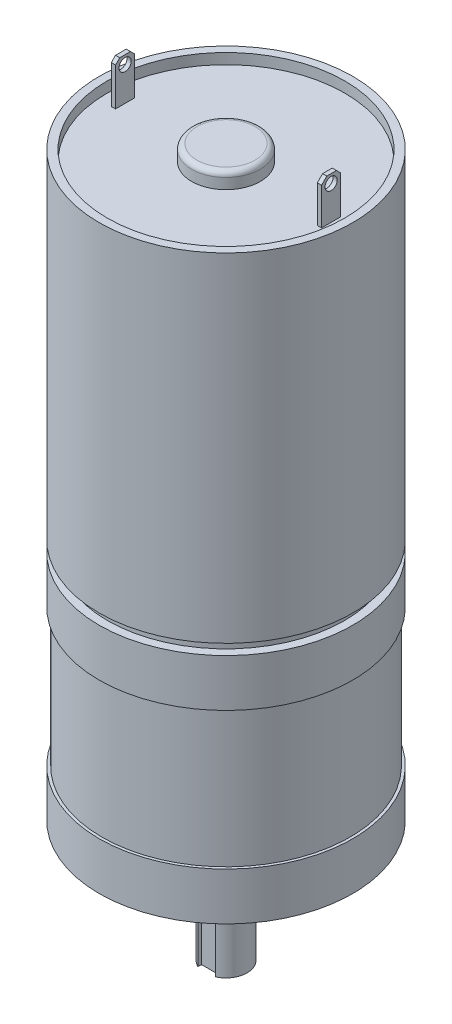
from build123d import *

# Parameters (mm, degrees)
SKETCH2_R           = 12
BOSS_EXTRUDE1_DEPTH = 27.5
SKETCH3_R           = 11.245365849
CUT_EXTRUDE1_DEPTH  = 1
CUT_EXTRUDE2_START  = -23
SKETCH4_R           = 12
SKETCH4_R_2         = 11.226713735
CUT_EXTRUDE2_DEPTH  = 1
CUT_EXTRUDE7_START  = -11
SKETCH5_R           = 12
SKETCH5_R_2         = 11.742388301
CUT_EXTRUDE7_DEPTH  = 6.5
SKETCH6_R           = 3.5
BOSS_EXTRUDE2_DEPTH = 2.5
SKETCH7_R           = 2
BOSS_EXTRUDE3_DEPTH = 9
CUT_EXTRUDE9_DEPTH  = 8
SKETCH9_R           = 3.25
BOSS_EXTRUDE4_DEPTH = 1.5
FILLET2_R           = 0.5
SKETCH10_W          = 0.399131897
SKETCH10_H          = 1.813679108
BOSS_EXTRUDE5_DEPTH = 4
CHAMFER1_SIZE       = 0.4
CHAMFER2_SIZE       = 0.5
SKETCH11_R          = 0.578483289
CUT_EXTRUDE10_DEPTH = 4
CHAMFER3_SIZE       = 0.4
CHAMFER4_SIZE       = 0.4


with BuildPart() as part:
    # Sketch2 → Boss-Extrude1 (new, symmetric)
    with BuildSketch(Plane(origin=(0, 0, 0), x_dir=(1, 0, 0), z_dir=(0, 1, 0))):
        with Locations(Location((0, 0, 0), (0, 0, 270))):
            Circle(SKETCH2_R)
    extrude(amount=BOSS_EXTRUDE1_DEPTH, both=True)

    # Sketch3 → Cut-Extrude1 (cut)
    with BuildSketch(Plane(origin=(0, 27.5, 0), x_dir=(1, 0, 0), z_dir=(0, 1, 0))):
        with Locations(Location((0, 0, 0), (0, 0, 270))):
            Circle(SKETCH3_R)
    extrude(amount=-CUT_EXTRUDE1_DEPTH, mode=Mode.SUBTRACT)

    # Sketch4 → Cut-Extrude2 (cut)
    with BuildSketch(Plane.XZ.offset(27.5).offset(CUT_EXTRUDE2_START)):
        with Locations(Location((0, 0, 0), (0, 0, 270))):
            Circle(SKETCH4_R)
        with Locations(Location((0, 0, 0), (0, 0, 270))):
            Circle(SKETCH4_R_2, mode=Mode.SUBTRACT)
    extrude(amount=CUT_EXTRUDE2_DEPTH, mode=Mode.SUBTRACT)

    # Sketch5 → Cut-Extrude7 (cut, symmetric)
    with BuildSketch(Plane.XZ.offset(27.5).offset(CUT_EXTRUDE7_START)):
        with Locations(Location((0, 0, 0), (0, 0, 270))):
            Circle(SKETCH5_R)
        with Locations(Location((0, 0, 0), (0, 0, 270))):
            Circle(SKETCH5_R_2, mode=Mode.SUBTRACT)
    extrude(amount=CUT_EXTRUDE7_DEPTH, both=True, mode=Mode.SUBTRACT)

    # Sketch6 → Boss-Extrude2 (add)
    with BuildSketch(Plane.XZ.offset(27.5)):
        with Locations(Location((0, 0, 0), (0, 0, 270))):
            Circle(SKETCH6_R)
    extrude(amount=BOSS_EXTRUDE2_DEPTH)

    # Sketch7 → Boss-Extrude3 (add)
    with BuildSketch(Plane.XZ.offset(30)):
        with Locations(Location((0, 0, 0), (0, 0, 270))):
            Circle(SKETCH7_R)
    extrude(amount=BOSS_EXTRUDE3_DEPTH)

    # Sketch8 → Cut-Extrude9 (cut)
    with BuildSketch(Plane.XZ.offset(39)):
        Polygon((0.841690599, 1.659275507), (0.841690599, 2.202635472), (-0.841690599, 2.202635472), (-0.841690599, 1.659275507), (-0.841690599, 1.478155518), (0.841690599, 1.478155518), align=None)
    extrude(amount=-CUT_EXTRUDE9_DEPTH, mode=Mode.SUBTRACT)

    # Sketch9 → Boss-Extrude4 (add)
    with BuildSketch(Plane(origin=(0, 26.5, 0), x_dir=(1, 0, 0), z_dir=(0, 1, 0))):
        with Locations(Location((0, 0, 0), (0, 0, 270))):
            Circle(SKETCH9_R)
    extrude(amount=BOSS_EXTRUDE4_DEPTH)

    # Fillet2
    fillet2_edges = [part.edges().sort_by_distance(p)[0] for p in [
        (0, 28, -3.25),
    ]]
    fillet(fillet2_edges, radius=FILLET2_R)

    # Sketch10 → Boss-Extrude5 (add)
    with BuildSketch(Plane(origin=(0, 26.5, 0), x_dir=(1, 0, 0), z_dir=(0, 1, 0))):
        with Locations((9.751397246, 0)):
            Rectangle(SKETCH10_W, SKETCH10_H)
    boss_extrude5 = extrude(amount=BOSS_EXTRUDE5_DEPTH)

    # Chamfer1
    chamfer1_edges = [part.edges().sort_by_distance(p)[0] for p in [
        (9.751397246, 30.5, -0.906839554),
    ]]
    chamfer(chamfer1_edges, length=CHAMFER1_SIZE)

    # Chamfer2
    chamfer2_edges = [part.edges().sort_by_distance(p)[0] for p in [
        (9.751397246, 30.5, 0.906839554),
    ]]
    chamfer(chamfer2_edges, length=CHAMFER2_SIZE)

    # Sketch11 → Cut-Extrude10 (cut)
    with BuildSketch(Plane(origin=(9.950963194, 0, 0), x_dir=(0, 0, -1), z_dir=(1, 0, 0))):
        with Locations((0, 29.682123993)):
            Circle(SKETCH11_R)
    cut_extrude10 = extrude(amount=-CUT_EXTRUDE10_DEPTH, mode=Mode.SUBTRACT)

    # Mirror1: Boss-Extrude5 across plane
    add(boss_extrude5.mirror(Plane(origin=(0, 0, 0), x_dir=(0, 0, 1), z_dir=(1, 0, 0))))

    # Mirror5: Cut-Extrude10 across plane
    add(cut_extrude10.mirror(Plane(origin=(0, 0, 0), x_dir=(0, 0, 1), z_dir=(1, 0, 0))), mode=Mode.SUBTRACT)

    # Chamfer3
    chamfer3_edges = [part.edges().sort_by_distance(p)[0] for p in [
        (-9.751397246, 30.5, -0.906839554),
    ]]
    chamfer(chamfer3_edges, length=CHAMFER3_SIZE)

    # Chamfer4
    chamfer4_edges = [part.edges().sort_by_distance(p)[0] for p in [
        (-9.751397246, 30.5, 0.906839554),
    ]]
    chamfer(chamfer4_edges, length=CHAMFER4_SIZE)


solid = part.part
